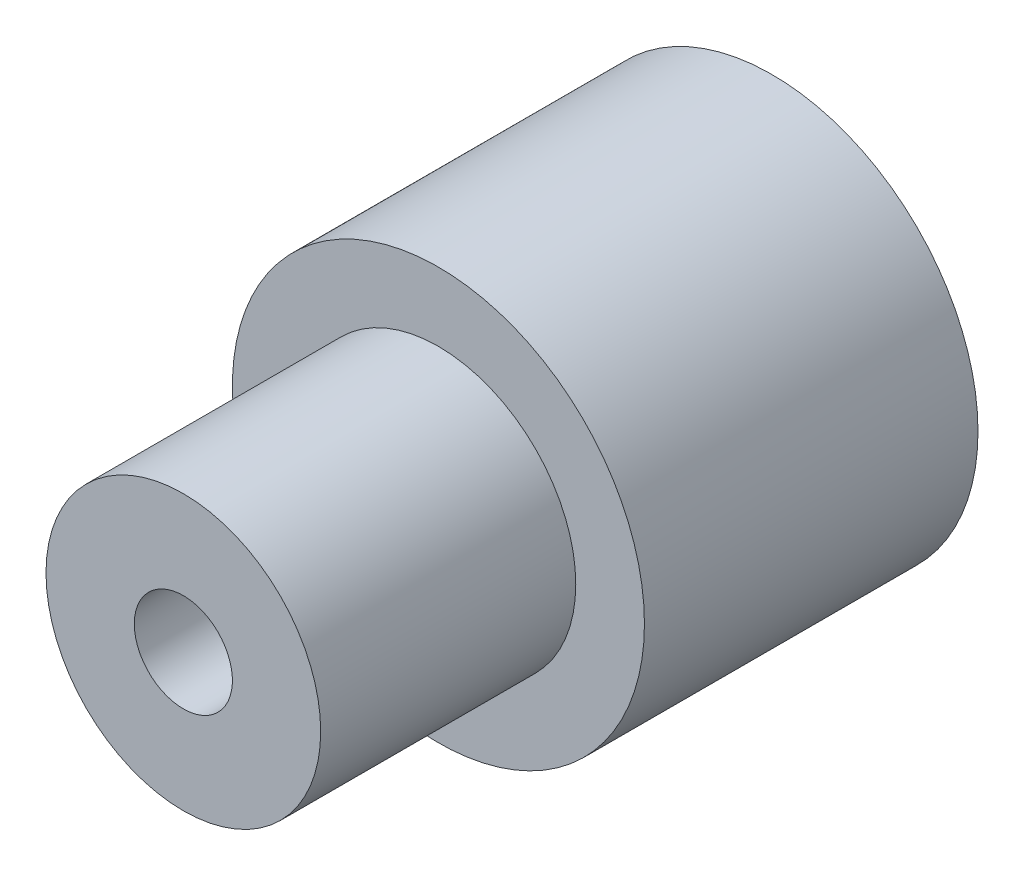
from build123d import *

# Parameters (mm, degrees)
CROQUIS1_R              = 10.5
CROQUIS1_R_2            = 7
SALIENTE_EXTRUIR1_DEPTH = 17
CROQUIS2_R              = 7
SALIENTE_EXTRUIR2_DEPTH = 30
CROQUIS3_R              = 2.5
CORTAR_EXTRUIR1_DEPTH   = 58


with BuildPart() as part:
    # Croquis1 → Saliente-Extruir1 (new body)
    # profile 1 of 2: a face of its own
    with BuildSketch(Plane.XY):
        Circle(CROQUIS1_R)
        Circle(CROQUIS1_R_2, mode=Mode.SUBTRACT)
    # profile 2 of 2: a face of its own
    with BuildSketch(Plane.XY):
        Circle(CROQUIS1_R_2)
    extrude(amount=SALIENTE_EXTRUIR1_DEPTH)

    # Croquis2 → Saliente-Extruir2 (add)
    with BuildSketch(Plane.XY):
        Circle(CROQUIS2_R)
    extrude(amount=SALIENTE_EXTRUIR2_DEPTH)

    # Croquis3 → Cortar-Extruir1 (cut)
    with BuildSketch(Plane.XY):
        with Locations(Location((0, 0, 0), (0, 0, 180))):
            Circle(CROQUIS3_R)
    extrude(amount=CORTAR_EXTRUIR1_DEPTH, mode=Mode.SUBTRACT)


solid = part.part
